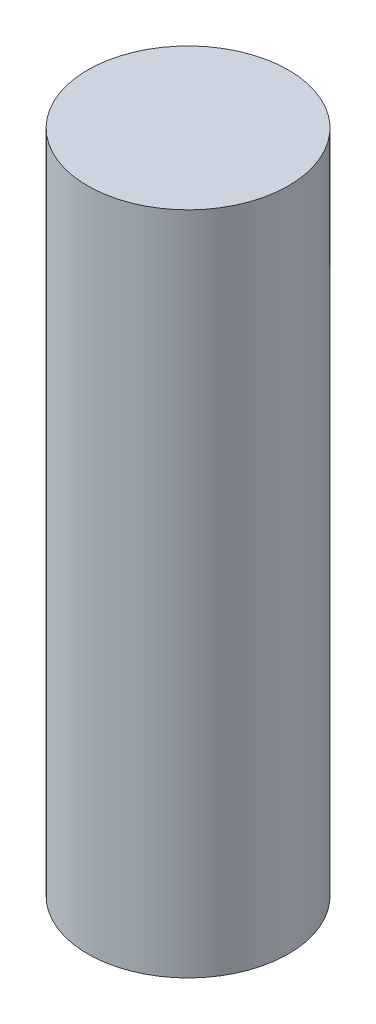
from build123d import *

# Parameters (mm, degrees)
SKETCH2_R           = 23
BOSS_EXTRUDE1_DEPTH = 152.4


with BuildPart() as part:
    # Sketch2 → Boss-Extrude1 (new body)
    with BuildSketch(Plane(origin=(0, 0, 0), x_dir=(1, 0, 0), z_dir=(0, 1, 0))):
        with Locations(Location((0, 0, 0), (0, 0, 90))):
            Circle(SKETCH2_R)
    extrude(amount=BOSS_EXTRUDE1_DEPTH)


solid = part.part
